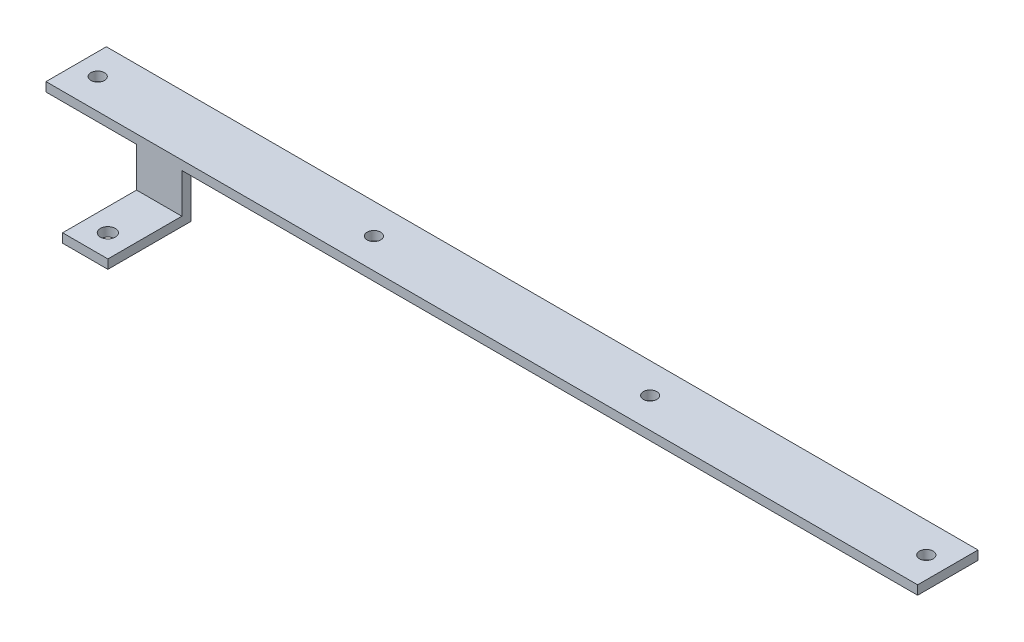
from build123d import *

# Parameters (mm, degrees)
SKETCH1_W           = 1155
SKETCH1_H           = 80
BOSS_EXTRUDE1_DEPTH = 12
SKETCH2_R           = 9
CUT_EXTRUDE1_DEPTH  = 580.007987855
LPATTERN1_COUNT     = 4
LPATTERN1_PITCH     = 366
SKETCH3_W           = 60
SKETCH3_H           = 98
SKETCH3_R           = 10
BOSS_EXTRUDE2_DEPTH = 12
SKETCH4_W           = 60
SKETCH4_H           = 12
BOSS_EXTRUDE3_DEPTH = 52.5
SKETCH6_W           = 60
SKETCH6_H           = 110
SKETCH6_R           = 10
BOSS_EXTRUDE4_DEPTH = 12
SKETCH7_W           = 60
SKETCH7_H           = 98
CUT_EXTRUDE2_DEPTH  = 12


with BuildPart() as part:
    # Sketch1 → Boss-Extrude1 (new body)
    with BuildSketch(Plane(origin=(0, 0, 0), x_dir=(1, 0, 0), z_dir=(0, 1, 0))):
        Rectangle(SKETCH1_W, SKETCH1_H)
    extrude(amount=BOSS_EXTRUDE1_DEPTH)

    # Sketch2 → Cut-Extrude1 (cut, symmetric)
    with BuildSketch(Plane(origin=(0, 12, 0), x_dir=(1, 0, 0), z_dir=(0, 1, 0))):
        with Locations(Location((-549, 0, 0), (0, 0, 270))):
            Circle(SKETCH2_R)
    cut_extrude1 = extrude(amount=CUT_EXTRUDE1_DEPTH, both=True, mode=Mode.SUBTRACT)

    # LPattern1: Cut-Extrude1 ×4
    with Locations(*[(i * LPATTERN1_PITCH, 0, 0) for i in range(1, LPATTERN1_COUNT)]):
        add(cut_extrude1, mode=Mode.SUBTRACT)

    # Sketch3 → Boss-Extrude2 (add)
    with BuildSketch(Plane(origin=(0, 12, 0), x_dir=(1, 0, 0), z_dir=(0, 1, 0))):
        with Locations((-427.5, -89)):
            Rectangle(SKETCH3_W, SKETCH3_H)
        with Locations(Location((-427.5, -108, 0), (0, 0, 270))):
            Circle(SKETCH3_R, mode=Mode.SUBTRACT)
    extrude(amount=-BOSS_EXTRUDE2_DEPTH)

    # Sketch4 → Boss-Extrude3 (add)
    with BuildSketch(Plane(origin=(0, 0, 0), x_dir=(-1, 0, 0), z_dir=(0, -1, 0))):
        with Locations((427.5, -34)):
            Rectangle(SKETCH4_W, SKETCH4_H)
    extrude(amount=BOSS_EXTRUDE3_DEPTH)

    # Sketch6 → Boss-Extrude4 (add)
    with BuildSketch(Plane.XZ.offset(52.5)):
        with Locations((-427.5, 83)):
            Rectangle(SKETCH6_W, SKETCH6_H)
        with Locations(Location((-427.5, 108, 0), (0, 0, 90))):
            Circle(SKETCH6_R, mode=Mode.SUBTRACT)
    extrude(amount=BOSS_EXTRUDE4_DEPTH)

    # Sketch7 → Cut-Extrude2 (cut)
    with BuildSketch(Plane(origin=(0, 12, 0), x_dir=(1, 0, 0), z_dir=(0, 1, 0))):
        with Locations((-427.5, -89)):
            Rectangle(SKETCH7_W, SKETCH7_H)
    extrude(amount=-CUT_EXTRUDE2_DEPTH, mode=Mode.SUBTRACT)


solid = part.part
